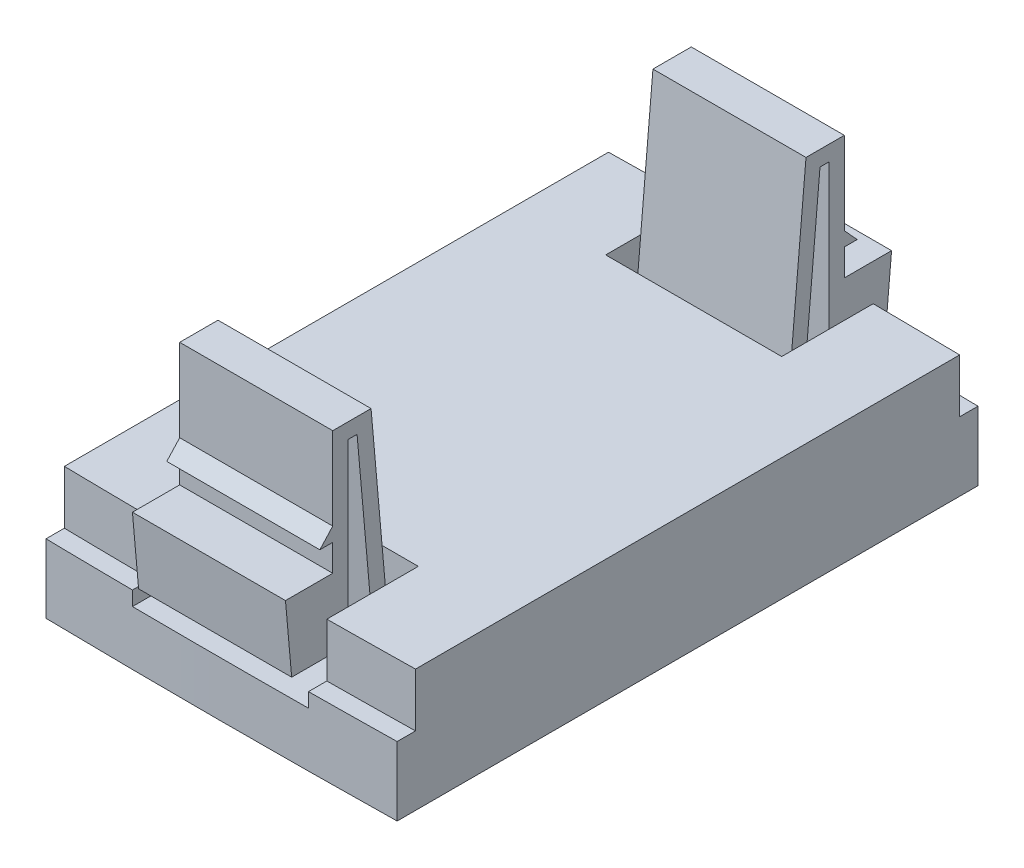
from build123d import *

# Parameters (mm, degrees)
SKETCH1_W           = 160
SKETCH1_H           = 80
BOSS_EXTRUDE1_DEPTH = 8
SKETCH2_W           = 160
SKETCH2_H           = 80
CUT_EXTRUDE1_DEPTH  = 90.799777283
CUT_EXTRUDE5_DEPTH  = 3.5
SKETCH6_W           = 10.5
SKETCH6_H           = 11
CUT_EXTRUDE6_DEPTH  = 3.5
BOSS_EXTRUDE2_DEPTH = 5
SKETCH13_W          = 202.95713844
SKETCH13_H          = 134.766583704
SKETCH13_W_2        = 22.9414187
SKETCH13_H_2        = 39.597863293
CUT_EXTRUDE7_DEPTH  = 10
CUT_EXTRUDE8_DEPTH  = 3.5
CUT_EXTRUDE9_START  = -2
SKETCH16_W          = 11.5
SKETCH16_H          = 0.936372799
CUT_EXTRUDE9_DEPTH  = 12


with BuildPart() as part:
    # Sketch1 → Boss-Extrude1 (new body)
    with BuildSketch(Plane(origin=(0, 0, 0), x_dir=(1, 0, 0), z_dir=(0, 1, 0))):
        Rectangle(SKETCH1_W, SKETCH1_H)
    extrude(amount=BOSS_EXTRUDE1_DEPTH)

    # Sketch2 → Cut-Extrude1 (cut, through all)
    with BuildSketch(Plane(origin=(0, 8, 0), x_dir=(1, 0, 0), z_dir=(0, 1, 0))):
        Rectangle(SKETCH2_W, SKETCH2_H)
        with BuildLine():
            ThreePointArc((-73.066951559, -31.066887131), (-71.100040398, -34.512464463), (-67.472075966, -36.118271655))
            ThreePointArc((-67.472075966, -36.118271655), (0, -39.461072151), (67.472075966, -36.118271655))
            ThreePointArc((67.472075966, -36.118271655), (71.100040398, -34.512464463), (73.066951559, -31.066887131))
            ThreePointArc((73.066951559, -31.066887131), (76.2, 0), (73.066951559, 31.066887131))
            ThreePointArc((73.066951559, 31.066887131), (71.100040398, 34.512464463), (67.472075966, 36.118271655))
            ThreePointArc((67.472075966, 36.118271655), (0, 39.461072151), (-67.472075966, 36.118271655))
            ThreePointArc((-67.472075966, 36.118271655), (-71.100040398, 34.512464463), (-73.066951559, 31.066887131))
            ThreePointArc((-73.066951559, 31.066887131), (-76.2, 0), (-73.066951559, -31.066887131))
        make_face(mode=Mode.SUBTRACT)
    extrude(amount=-CUT_EXTRUDE1_DEPTH, mode=Mode.SUBTRACT)

    # Sketch3 → Cut-Extrude5 (cut)
    with BuildSketch(Plane(origin=(0, 8, 0), x_dir=(1, 0, 0), z_dir=(0, 1, 0))):
        with BuildLine():
            ThreePointArc((-67.472075966, -36.118271655), (0, -39.461072151), (67.472075966, -36.118271655))
            ThreePointArc((67.472075966, -36.118271655), (71.100040398, -34.512464463), (73.066951559, -31.066887131))
            ThreePointArc((73.066951559, -31.066887131), (76.2, 0), (73.066951559, 31.066887131))
            ThreePointArc((73.066951559, 31.066887131), (71.100040398, 34.512464463), (67.472075966, 36.118271655))
            ThreePointArc((67.472075966, 36.118271655), (0, 39.461072151), (-67.472075966, 36.118271655))
            ThreePointArc((-67.472075966, 36.118271655), (-71.100040398, 34.512464463), (-73.066951559, 31.066887131))
            ThreePointArc((-73.066951559, 31.066887131), (-76.2, 0), (-73.066951559, -31.066887131))
            ThreePointArc((-73.066951559, -31.066887131), (-71.100040398, -34.512464463), (-67.472075966, -36.118271655))
        make_face()
        with BuildLine():
            ThreePointArc((-71.891114808, -30.827287598), (-70.295876764, -33.621778857), (-67.35346279, -34.924148163))
            ThreePointArc((-67.35346279, -34.924148163), (0, -38.261072151), (67.35346279, -34.924148163))
            ThreePointArc((67.35346279, -34.924148163), (70.295876764, -33.621778857), (71.891114808, -30.827287598))
            ThreePointArc((71.891114808, -30.827287598), (75, 0), (71.891114808, 30.827287598))
            ThreePointArc((71.891114808, 30.827287598), (70.295876764, 33.621778857), (67.35346279, 34.924148163))
            ThreePointArc((67.35346279, 34.924148163), (0, 38.261072151), (-67.35346279, 34.924148163))
            ThreePointArc((-67.35346279, 34.924148163), (-70.295876764, 33.621778857), (-71.891114808, 30.827287598))
            ThreePointArc((-71.891114808, 30.827287598), (-75, 0), (-71.891114808, -30.827287598))
        make_face(mode=Mode.SUBTRACT)
    extrude(amount=-CUT_EXTRUDE5_DEPTH, mode=Mode.SUBTRACT)

    # Sketch6 → Cut-Extrude6 (cut)
    with BuildSketch(Plane(origin=(0, 8, 0), x_dir=(1, 0, 0), z_dir=(0, 1, 0))):
        with Locations((0, -38.261072151)):
            Rectangle(SKETCH6_W, SKETCH6_H)
    extrude(amount=-CUT_EXTRUDE6_DEPTH, mode=Mode.SUBTRACT)

    # Sketch5 → Boss-Extrude2 (add, symmetric)
    with BuildSketch(Plane(origin=(0, 0, 0), x_dir=(0, 0, -1), z_dir=(1, 0, 0))):
        Polygon((-33.423273075, 4.5), (-34.597814339, 17.722195507), (-37.101805657, 17.722195507), (-37.101805657, 12.32309307), (-37.944117027, 11.404206925), (-37.101805657, 11.404206925), (-37.101805657, 9.653632864), (-40.188830506, 9.653632864), (-39.785685871, 5.115301729), (-36.101805657, 5.115301729), (-36.101805657, 8.653632864), (-36.101805657, 16.722195507), (-35.51292103, 16.722195507), (-34.427210798, 4.5), align=None)
    extrude(amount=BOSS_EXTRUDE2_DEPTH, both=True)

    # Sketch13 → Cut-Extrude7 (cut)
    with BuildSketch(Plane(origin=(0, 0, 0), x_dir=(1, 0, 0), z_dir=(0, 1, 0))):
        with Locations((1.229729327, -18.57056388)):
            Rectangle(SKETCH13_W, SKETCH13_H)
        with Locations((0, -40.188830507)):
            Rectangle(SKETCH13_W_2, SKETCH13_H_2, mode=Mode.SUBTRACT)
    extrude(amount=CUT_EXTRUDE7_DEPTH, mode=Mode.SUBTRACT)

    # Mirror2: part across plane


with BuildPart() as part_1:
    add(part.part)
    add(part.part.mirror(Plane(origin=(-11.47070935, 10, 20.38989886), x_dir=(1, 0, 0), z_dir=(0, 0, 1))))

    # Sketch14 → Cut-Extrude8 (cut)
    with BuildSketch(Plane(origin=(0, 8, 0), x_dir=(1, 0, 0), z_dir=(0, 1, 0))):
        Polygon((-5.75, -38.24084723), (-5.75, -32.261072151), (5.75, -32.261072151), (5.75, -38.24084723), (5.25, -38.24084723), (5.25, -32.761072151), (-5.25, -32.761072151), (-5.25, -38.24084723), align=None)
        Polygon((5.75, -2.538950489), (5.75, -8.518725569), (-5.75, -8.518725569), (-5.75, -2.538950489), (-5.25, -2.538950489), (-5.25, -8.018725569), (5.25, -8.018725569), (5.25, -2.538950489), align=None)
    extrude(amount=-CUT_EXTRUDE8_DEPTH, mode=Mode.SUBTRACT)

    # Sketch16 → Cut-Extrude9 (cut)
    with BuildSketch(Plane.XY.offset(37.101805657).offset(CUT_EXTRUDE9_START)):
        with Locations((0, 4.0318136)):
            Rectangle(SKETCH16_W, SKETCH16_H)
    cut_extrude9 = extrude(amount=CUT_EXTRUDE9_DEPTH, mode=Mode.SUBTRACT)

    # Mirror3: Cut-Extrude9 across plane
    add(cut_extrude9.mirror(Plane.XY.offset(20.38989886)), mode=Mode.SUBTRACT)


solid = part_1.part
